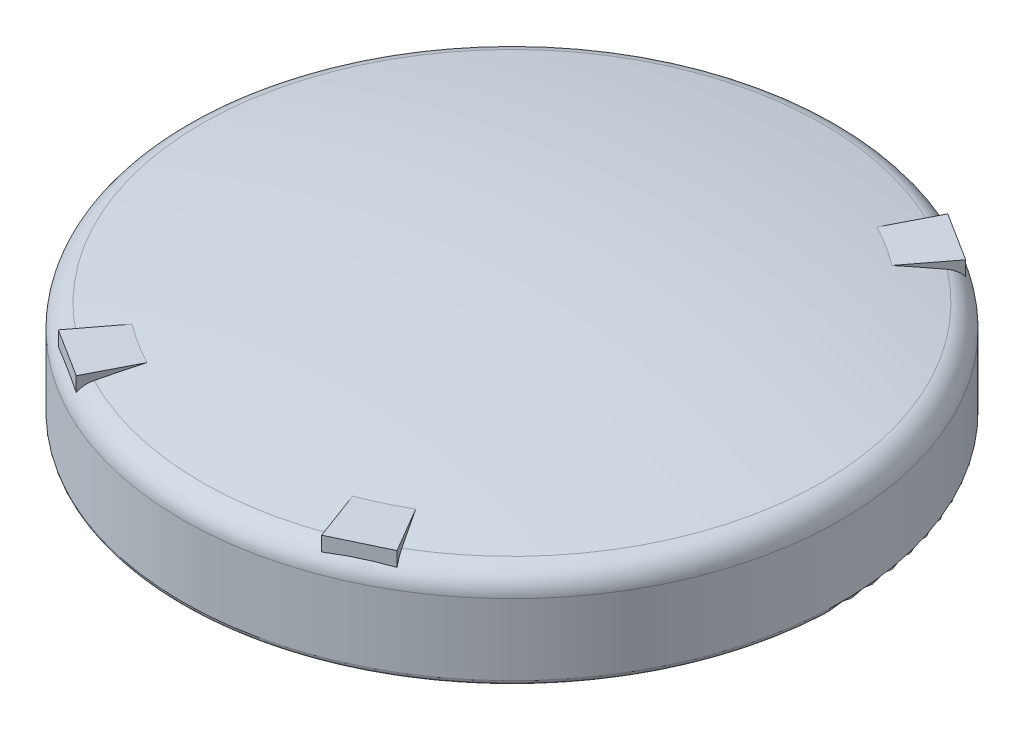
from build123d import *

# Parameters (mm, degrees)
SKETCH2_R           = 0.525
BOSS_EXTRUDE4_DEPTH = 3.6
BOSS_EXTRUDE5_DEPTH = 2.6
SKETCH5_R           = 1
BOSS_EXTRUDE6_DEPTH = 1.55


with BuildPart() as part:
    # Sketch1 → Revolve1 (revolve)
    with BuildSketch(Plane.XY, mode=Mode.PRIVATE) as revolve1_sk:
        with BuildLine():
            Line((11.85, 0.8), (11.85, 0.5))
            Line((11.85, 0.5), (12.25, 0))
            Line((12.25, 0), (13.8, 0))
            ThreePointArc((13.8, 0), (13.941421356, 0.058578644), (14, 0.2))
            Line((14, 0.2), (14, 3.218839302))
            ThreePointArc((14, 3.218839302), (13.770624952, 3.856128235), (13.187725632, 4.201060808))
            ThreePointArc((13.187725632, 4.201060808), (6.623366901, 5.137068218), (0, 5.45))
            Line((0, 5.45), (0, 4.65))
            ThreePointArc((0, 4.65), (6.161146764, 4.376171985), (12.273709091, 3.556847244))
            ThreePointArc((12.273709091, 3.556847244), (12.686934057, 3.316977598), (12.85, 2.867865342))
            Line((12.85, 2.867865342), (12.85, 0.8))
            Line((12.85, 0.8), (11.85, 0.8))
        make_face()
    revolve(revolve1_sk.sketch.rotate(Axis((0, 4.3, 0), (0, 1, 0)), 90), axis=Axis((0, 4.3, 0), (0, 1, 0)))

    # Sketch2 → Boss-Extrude4 (add)
    with BuildSketch(Plane(origin=(0, 4.5, 0), x_dir=(-1, 0, 0), z_dir=(0, 1, 0))):
        with Locations(Location((-6, -9.5, 0), (0, 0, 90))):
            Circle(SKETCH2_R)
        with Locations(Location((-4.92009901, 10.339009901, 0), (0, 0, 90))):
            Circle(SKETCH2_R)
        with Locations(Location((6, 9.5, 0), (0, 0, 90))):
            Circle(SKETCH2_R)
    extrude(amount=-BOSS_EXTRUDE4_DEPTH)

    # Sketch3 → Boss-Extrude5 (add)
    with BuildSketch(Plane(origin=(0, 4.5, 0), x_dir=(-1, 0, 0), z_dir=(0, 1, 0))):
        with BuildLine():
            Line((5.110341472, 9.956626438), (6.278613529, 12.232804754))
            Line((6.278613529, 12.232804754), (8.34792046, 10.925874061))
            Line((8.34792046, 10.925874061), (6.794609023, 8.892878512))
            ThreePointArc((6.794609023, 8.892878512), (5.466007009, 8.654511097), (5.110341472, 9.956626438))
        make_face()
        with BuildLine():
            Line((-6.794609023, -8.892878512), (-8.34792046, -10.925874061))
            Line((-8.34792046, -10.925874061), (-6.278613529, -12.232804754))
            Line((-6.278613529, -12.232804754), (-5.110341472, -9.956626438))
            ThreePointArc((-5.110341472, -9.956626438), (-5.466007009, -8.654511097), (-6.794609023, -8.892878512))
        make_face()
        with BuildLine():
            Line((-6.97019211, 11.852380434), (-4.801486156, 12.884418135))
            Line((-4.801486156, 12.884418135), (-3.983050418, 10.688208894))
            ThreePointArc((-3.983050418, 10.688208894), (-4.49039604, 9.436039604), (-5.782090314, 9.832086838))
            Line((-5.782090314, 9.832086838), (-6.97019211, 11.852380434))
        make_face()
    extrude(amount=-BOSS_EXTRUDE5_DEPTH)


with BuildPart() as body_2:
    # Sketch5 → Boss-Extrude6 (new body)
    with BuildSketch(Plane(origin=(0, 4.5, 0), x_dir=(-1, 0, 0), z_dir=(0, 1, 0))):
        with Locations(Location((1.375049505, -2.88950495, 0), (0, 0, 90))):
            Circle(SKETCH5_R)
    extrude(amount=-BOSS_EXTRUDE6_DEPTH)


solid = Compound([part.part, body_2.part])
